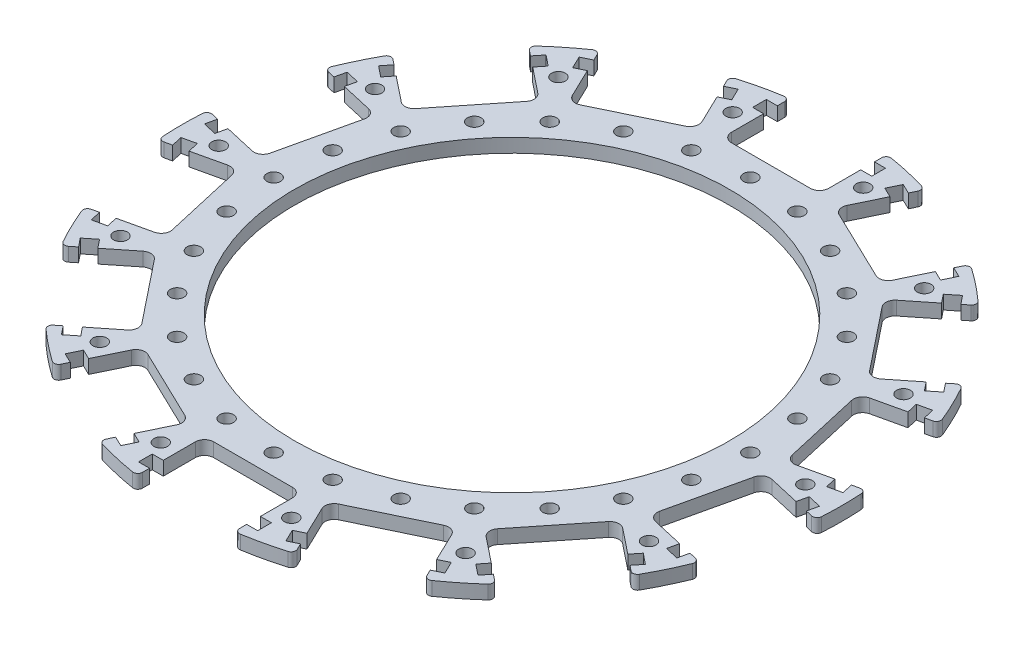
from build123d import *

# Parameters (mm, degrees)
EXTRUDE_1_DEPTH     = 3
FILLET_1_R          = 2
FILLET_2_R          = 1
SKETCH_2_R          = 1.5
CUT_EXTRUDE_1_DEPTH = 11
SKETCH_3_R          = 52.5
SKETCH_3_R_2        = 28
SKETCH_3_R_3        = 9
CUT_EXTRUDE_2_DEPTH = 11
SKETCH_4_R          = 52.5
SKETCH_4_R_2        = 47.5
EXTRUDE_2_DEPTH     = 3
SKETCH_5_R          = 1.5
CUT_EXTRUDE_3_DEPTH = 3


with BuildPart() as part:
    # 草图1 → 凸台-拉伸1 (new body)
    with BuildSketch(Plane(origin=(0, 0, 0), x_dir=(1, 0, 0), z_dir=(0, 1, 0))):
        with BuildLine():
            Line((-10.6, -68.5), (-13, -68.5))
            Line((-13, -68.5), (-13, -65.5))
            Line((-13, -65.5), (-10.6, -65.5))
            Line((-10.6, -65.5), (-10.6, -56.5))
            Line((-10.6, -56.5), (10.6, -56.5))
            Line((10.6, -56.5), (10.6, -65.5))
            Line((10.6, -65.5), (13, -65.5))
            Line((13, -65.5), (13, -68.5))
            Line((13, -68.5), (10.6, -68.5))
            Line((10.6, -68.5), (10.6, -71.215447762))
            ThreePointArc((10.6, -71.215447762), (16.021507245, -70.194809677), (21.348954758, -68.762068982))
            Line((21.348954758, -68.762068982), (20.17076613, -66.315535086))
            Line((20.17076613, -66.315535086), (18.008440847, -67.35685606))
            Line((18.008440847, -67.35685606), (16.706789629, -64.653949456))
            Line((16.706789629, -64.653949456), (18.869114912, -63.612628482))
            Line((18.869114912, -63.612628482), (14.96416126, -55.503908671))
            Line((14.96416126, -55.503908671), (34.06470126, -46.305573402))
            Line((34.06470126, -46.305573402), (37.969654912, -54.414293213))
            Line((37.969654912, -54.414293213), (40.131980195, -53.372972239))
            Line((40.131980195, -53.372972239), (41.433631412, -56.075878843))
            Line((41.433631412, -56.075878843), (39.271306129, -57.117199817))
            Line((39.271306129, -57.117199817), (40.449494758, -59.563733713))
            ThreePointArc((40.449494758, -59.563733713), (44.891265734, -56.291866738), (49.069487199, -52.689519129))
            Line((49.069487199, -52.689519129), (46.946464649, -50.996465141))
            Line((46.946464649, -50.996465141), (45.450089125, -52.872860699))
            Line((45.450089125, -52.872860699), (43.104594677, -51.002391294))
            Line((43.104594677, -51.002391294), (44.600970202, -49.125995736))
            Line((44.600970202, -49.125995736), (37.56448686, -43.514587519))
            Line((37.56448686, -43.514587519), (50.782470659, -26.939760091))
            Line((50.782470659, -26.939760091), (57.818954001, -32.551168308))
            Line((57.818954001, -32.551168308), (59.315329526, -30.67477275))
            Line((59.315329526, -30.67477275), (61.660823973, -32.545242155))
            Line((61.660823973, -32.545242155), (60.164448449, -34.421637713))
            Line((60.164448449, -34.421637713), (62.287470998, -36.114691701))
            ThreePointArc((62.287470998, -36.114691701), (64.869758489, -31.239629216), (67.071205902, -26.181163817))
            Line((67.071205902, -26.181163817), (64.423840085, -25.576919845))
            Line((64.423840085, -25.576919845), (63.889789843, -27.916746834))
            Line((63.889789843, -27.916746834), (60.965006106, -27.249184033))
            Line((60.965006106, -27.249184033), (61.499056348, -24.909357043))
            Line((61.499056348, -24.909357043), (52.724705138, -22.906668638))
            Line((52.724705138, -22.906668638), (57.442148938, -2.238196899))
            Line((57.442148938, -2.238196899), (66.216500148, -4.240885305))
            Line((66.216500148, -4.240885305), (66.750550389, -1.901058316))
            Line((66.750550389, -1.901058316), (69.675334126, -2.568621118))
            Line((69.675334126, -2.568621118), (69.141283884, -4.908448107))
            Line((69.141283884, -4.908448107), (71.788649702, -5.512692079))
            ThreePointArc((71.788649702, -5.512692079), (71.947143024, -2.758371028), (72, 0))
            ThreePointArc((72, 0), (71.947143024, 2.758371028), (71.788649702, 5.512692079))
            Line((71.788649702, 5.512692079), (69.141283884, 4.908448107))
            Line((69.141283884, 4.908448107), (69.675334126, 2.568621118))
            Line((69.675334126, 2.568621118), (66.750550389, 1.901058316))
            Line((66.750550389, 1.901058316), (66.216500148, 4.240885305))
            Line((66.216500148, 4.240885305), (57.442148938, 2.238196899))
            Line((57.442148938, 2.238196899), (52.724705138, 22.906668638))
            Line((52.724705138, 22.906668638), (61.499056348, 24.909357043))
            Line((61.499056348, 24.909357043), (60.965006106, 27.249184033))
            Line((60.965006106, 27.249184033), (63.889789843, 27.916746834))
            Line((63.889789843, 27.916746834), (64.423840085, 25.576919845))
            Line((64.423840085, 25.576919845), (67.071205902, 26.181163817))
            ThreePointArc((67.071205902, 26.181163817), (64.869758489, 31.239629216), (62.287470998, 36.114691701))
            Line((62.287470998, 36.114691701), (60.164448449, 34.421637713))
            Line((60.164448449, 34.421637713), (61.660823973, 32.545242155))
            Line((61.660823973, 32.545242155), (59.315329526, 30.67477275))
            Line((59.315329526, 30.67477275), (57.818954001, 32.551168308))
            Line((57.818954001, 32.551168308), (50.782470659, 26.939760091))
            Line((50.782470659, 26.939760091), (37.56448686, 43.514587519))
            Line((37.56448686, 43.514587519), (44.600970202, 49.125995736))
            Line((44.600970202, 49.125995736), (43.104594677, 51.002391294))
            Line((43.104594677, 51.002391294), (45.450089125, 52.872860699))
            Line((45.450089125, 52.872860699), (46.946464649, 50.996465141))
            Line((46.946464649, 50.996465141), (49.069487199, 52.689519129))
            ThreePointArc((49.069487199, 52.689519129), (44.891265734, 56.291866738), (40.449494758, 59.563733713))
            Line((40.449494758, 59.563733713), (39.271306129, 57.117199817))
            Line((39.271306129, 57.117199817), (41.433631412, 56.075878843))
            Line((41.433631412, 56.075878843), (40.131980195, 53.372972239))
            Line((40.131980195, 53.372972239), (37.969654912, 54.414293213))
            Line((37.969654912, 54.414293213), (34.06470126, 46.305573402))
            Line((34.06470126, 46.305573402), (14.96416126, 55.503908671))
            Line((14.96416126, 55.503908671), (18.869114912, 63.612628482))
            Line((18.869114912, 63.612628482), (16.706789629, 64.653949456))
            Line((16.706789629, 64.653949456), (18.008440847, 67.35685606))
            Line((18.008440847, 67.35685606), (20.17076613, 66.315535086))
            Line((20.17076613, 66.315535086), (21.348954758, 68.762068982))
            ThreePointArc((21.348954758, 68.762068982), (16.021507245, 70.194809677), (10.6, 71.215447762))
            Line((10.6, 71.215447762), (10.6, 68.5))
            Line((10.6, 68.5), (13, 68.5))
            Line((13, 68.5), (13, 65.5))
            Line((13, 65.5), (10.6, 65.5))
            Line((10.6, 65.5), (10.6, 56.5))
            Line((10.6, 56.5), (-10.6, 56.5))
            Line((-10.6, 56.5), (-10.6, 65.5))
            Line((-10.6, 65.5), (-13, 65.5))
            Line((-13, 65.5), (-13, 68.5))
            Line((-13, 68.5), (-10.6, 68.5))
            Line((-10.6, 68.5), (-10.6, 71.215447762))
            ThreePointArc((-10.6, 71.215447762), (-16.021507245, 70.194809677), (-21.348954758, 68.762068982))
            Line((-21.348954758, 68.762068982), (-20.17076613, 66.315535086))
            Line((-20.17076613, 66.315535086), (-18.008440847, 67.35685606))
            Line((-18.008440847, 67.35685606), (-16.706789629, 64.653949456))
            Line((-16.706789629, 64.653949456), (-18.869114912, 63.612628482))
            Line((-18.869114912, 63.612628482), (-14.96416126, 55.503908671))
            Line((-14.96416126, 55.503908671), (-34.06470126, 46.305573402))
            Line((-34.06470126, 46.305573402), (-37.969654912, 54.414293213))
            Line((-37.969654912, 54.414293213), (-40.131980195, 53.372972239))
            Line((-40.131980195, 53.372972239), (-41.433631412, 56.075878843))
            Line((-41.433631412, 56.075878843), (-39.271306129, 57.117199817))
            Line((-39.271306129, 57.117199817), (-40.449494758, 59.563733713))
            ThreePointArc((-40.449494758, 59.563733713), (-44.891265734, 56.291866738), (-49.069487199, 52.689519129))
            Line((-49.069487199, 52.689519129), (-46.946464649, 50.996465141))
            Line((-46.946464649, 50.996465141), (-45.450089125, 52.872860699))
            Line((-45.450089125, 52.872860699), (-43.104594677, 51.002391294))
            Line((-43.104594677, 51.002391294), (-44.600970202, 49.125995736))
            Line((-44.600970202, 49.125995736), (-37.56448686, 43.514587519))
            Line((-37.56448686, 43.514587519), (-50.782470659, 26.939760091))
            Line((-50.782470659, 26.939760091), (-57.818954001, 32.551168308))
            Line((-57.818954001, 32.551168308), (-59.315329526, 30.67477275))
            Line((-59.315329526, 30.67477275), (-61.660823973, 32.545242155))
            Line((-61.660823973, 32.545242155), (-60.164448449, 34.421637713))
            Line((-60.164448449, 34.421637713), (-62.287470998, 36.114691701))
            ThreePointArc((-62.287470998, 36.114691701), (-64.869758489, 31.239629216), (-67.071205902, 26.181163817))
            Line((-67.071205902, 26.181163817), (-64.423840085, 25.576919845))
            Line((-64.423840085, 25.576919845), (-63.889789843, 27.916746834))
            Line((-63.889789843, 27.916746834), (-60.965006106, 27.249184033))
            Line((-60.965006106, 27.249184033), (-61.499056348, 24.909357043))
            Line((-61.499056348, 24.909357043), (-52.724705138, 22.906668638))
            Line((-52.724705138, 22.906668638), (-57.442148938, 2.238196899))
            Line((-57.442148938, 2.238196899), (-66.216500148, 4.240885305))
            Line((-66.216500148, 4.240885305), (-66.750550389, 1.901058316))
            Line((-66.750550389, 1.901058316), (-69.675334126, 2.568621118))
            Line((-69.675334126, 2.568621118), (-69.141283884, 4.908448107))
            Line((-69.141283884, 4.908448107), (-71.788649702, 5.512692079))
            ThreePointArc((-71.788649702, 5.512692079), (-72, 0), (-71.788649702, -5.512692079))
            Line((-71.788649702, -5.512692079), (-69.141283884, -4.908448107))
            Line((-69.141283884, -4.908448107), (-69.675334126, -2.568621118))
            Line((-69.675334126, -2.568621118), (-66.750550389, -1.901058316))
            Line((-66.750550389, -1.901058316), (-66.216500148, -4.240885305))
            Line((-66.216500148, -4.240885305), (-57.442148938, -2.238196899))
            Line((-57.442148938, -2.238196899), (-52.724705138, -22.906668638))
            Line((-52.724705138, -22.906668638), (-61.499056348, -24.909357043))
            Line((-61.499056348, -24.909357043), (-60.965006106, -27.249184033))
            Line((-60.965006106, -27.249184033), (-63.889789843, -27.916746834))
            Line((-63.889789843, -27.916746834), (-64.423840085, -25.576919845))
            Line((-64.423840085, -25.576919845), (-67.071205902, -26.181163817))
            ThreePointArc((-67.071205902, -26.181163817), (-64.869758489, -31.239629216), (-62.287470998, -36.114691701))
            Line((-62.287470998, -36.114691701), (-60.164448449, -34.421637713))
            Line((-60.164448449, -34.421637713), (-61.660823973, -32.545242155))
            Line((-61.660823973, -32.545242155), (-59.315329526, -30.67477275))
            Line((-59.315329526, -30.67477275), (-57.818954001, -32.551168308))
            Line((-57.818954001, -32.551168308), (-50.782470659, -26.939760091))
            Line((-50.782470659, -26.939760091), (-37.56448686, -43.514587519))
            Line((-37.56448686, -43.514587519), (-44.600970202, -49.125995736))
            Line((-44.600970202, -49.125995736), (-43.104594677, -51.002391294))
            Line((-43.104594677, -51.002391294), (-45.450089125, -52.872860699))
            Line((-45.450089125, -52.872860699), (-46.946464649, -50.996465141))
            Line((-46.946464649, -50.996465141), (-49.069487199, -52.689519129))
            ThreePointArc((-49.069487199, -52.689519129), (-44.891265734, -56.291866738), (-40.449494758, -59.563733713))
            Line((-40.449494758, -59.563733713), (-39.271306129, -57.117199817))
            Line((-39.271306129, -57.117199817), (-41.433631412, -56.075878843))
            Line((-41.433631412, -56.075878843), (-40.131980195, -53.372972239))
            Line((-40.131980195, -53.372972239), (-37.969654912, -54.414293213))
            Line((-37.969654912, -54.414293213), (-34.06470126, -46.305573402))
            Line((-34.06470126, -46.305573402), (-14.96416126, -55.503908671))
            Line((-14.96416126, -55.503908671), (-18.869114912, -63.612628482))
            Line((-18.869114912, -63.612628482), (-16.706789629, -64.653949456))
            Line((-16.706789629, -64.653949456), (-18.008440847, -67.35685606))
            Line((-18.008440847, -67.35685606), (-20.17076613, -66.315535086))
            Line((-20.17076613, -66.315535086), (-21.348954758, -68.762068982))
            ThreePointArc((-21.348954758, -68.762068982), (-16.021507245, -70.194809677), (-10.6, -71.215447762))
            Line((-10.6, -71.215447762), (-10.6, -68.5))
        make_face()
    extrude(amount=EXTRUDE_1_DEPTH)

    # 圆角1
    fillet_1_edges = [part.edges().sort_by_distance(p)[0] for p in [
        (10.6, 1.5, 56.5),
        (-10.6, 1.5, 56.5),
        (-14.96416126, 1.5, 55.503908671),
        (-34.06470126, 1.5, 46.305573402),
        (-37.56448686, 1.5, 43.514587519),
        (-50.782470659, 1.5, 26.939760091),
        (-52.724705138, 1.5, 22.906668638),
        (-57.442148938, 1.5, 2.238196899),
        (-57.442148938, 1.5, -2.238196899),
        (-52.724705138, 1.5, -22.906668638),
        (-50.782470659, 1.5, -26.939760091),
        (-37.56448686, 1.5, -43.514587519),
        (-34.06470126, 1.5, -46.305573402),
        (-14.96416126, 1.5, -55.503908671),
        (-10.6, 1.5, -56.5),
        (10.6, 1.5, -56.5),
        (14.96416126, 1.5, -55.503908671),
        (34.06470126, 1.5, -46.305573402),
        (37.56448686, 1.5, -43.514587519),
        (50.782470659, 1.5, -26.939760091),
        (52.724705138, 1.5, -22.906668638),
        (57.442148938, 1.5, -2.238196899),
        (57.442148938, 1.5, 2.238196899),
        (52.724705138, 1.5, 22.906668638),
        (50.782470659, 1.5, 26.939760091),
        (37.56448686, 1.5, 43.514587519),
        (34.06470126, 1.5, 46.305573402),
        (14.96416126, 1.5, 55.503908671),
    ]]
    fillet(fillet_1_edges, radius=FILLET_1_R)

    # 圆角2
    fillet_2_edges = [part.edges().sort_by_distance(p)[0] for p in [
        (-10.6, 1.5, 71.215447762),
        (-21.348954758, 1.5, 68.762068982),
        (-40.449494758, 1.5, 59.563733713),
        (-49.069487199, 1.5, 52.689519129),
        (-62.287470998, 1.5, 36.114691701),
        (-67.071205902, 1.5, 26.181163817),
        (-71.788649702, 1.5, 5.512692079),
        (-71.788649702, 1.5, -5.512692079),
        (-67.071205902, 1.5, -26.181163817),
        (-62.287470998, 1.5, -36.114691701),
        (-49.069487199, 1.5, -52.689519129),
        (-40.449494758, 1.5, -59.563733713),
        (-21.348954758, 1.5, -68.762068982),
        (-10.6, 1.5, -71.215447762),
        (10.6, 1.5, -71.215447762),
        (21.348954758, 1.5, -68.762068982),
        (40.449494758, 1.5, -59.563733713),
        (49.069487199, 1.5, -52.689519129),
        (62.287470998, 1.5, -36.114691701),
        (67.071205902, 1.5, -26.181163817),
        (71.788649702, 1.5, -5.512692079),
        (71.788649702, 1.5, 5.512692079),
        (67.071205902, 1.5, 26.181163817),
        (62.287470998, 1.5, 36.114691701),
        (49.069487199, 1.5, 52.689519129),
        (40.449494758, 1.5, 59.563733713),
        (21.348954758, 1.5, 68.762068982),
        (10.6, 1.5, 71.215447762),
    ]]
    fillet(fillet_2_edges, radius=FILLET_2_R)

    # 草图2 → 切除-拉伸1 (cut)
    with BuildSketch(Plane(origin=(0, 0, 0), x_dir=(1, 0, 0), z_dir=(0, 1, 0))):
        with Locations(Location((64, 0, 0), (0, 0, 270))):
            Circle(SKETCH_2_R)
        with Locations(Location((57.662007546, -27.768559304, 0), (0, 0, 270))):
            Circle(SKETCH_2_R)
        with Locations(Location((39.903347319, -50.037214878, 0), (0, 0, 270))):
            Circle(SKETCH_2_R)
        with Locations(Location((14.241339773, -62.39538638, 0), (0, 0, 270))):
            Circle(SKETCH_2_R)
        with Locations(Location((-14.241339773, -62.39538638, 0), (0, 0, 270))):
            Circle(SKETCH_2_R)
        with Locations(Location((-39.903347319, -50.037214878, 0), (0, 0, 270))):
            Circle(SKETCH_2_R)
        with Locations(Location((-57.662007546, -27.768559304, 0), (0, 0, 270))):
            Circle(SKETCH_2_R)
        with Locations(Location((-64, 0, 0), (0, 0, 270))):
            Circle(SKETCH_2_R)
        with Locations(Location((-57.662007546, 27.768559304, 0), (0, 0, 270))):
            Circle(SKETCH_2_R)
        with Locations(Location((-39.903347319, 50.037214878, 0), (0, 0, 270))):
            Circle(SKETCH_2_R)
        with Locations(Location((-14.241339773, 62.39538638, 0), (0, 0, 270))):
            Circle(SKETCH_2_R)
        with Locations(Location((14.241339773, 62.39538638, 0), (0, 0, 270))):
            Circle(SKETCH_2_R)
        with Locations(Location((39.903347319, 50.037214878, 0), (0, 0, 270))):
            Circle(SKETCH_2_R)
        with Locations(Location((57.662007546, 27.768559304, 0), (0, 0, 270))):
            Circle(SKETCH_2_R)
    extrude(amount=CUT_EXTRUDE_1_DEPTH, mode=Mode.SUBTRACT)

    # 草图3 → 切除-拉伸2 (cut)
    # profile 1 of 2: a face of its own
    with BuildSketch(Plane(origin=(0, 0, 0), x_dir=(1, 0, 0), z_dir=(0, 1, 0))):
        with Locations(Location((0, 0, 0), (0, 0, 270))):
            Circle(SKETCH_3_R)
        Circle(SKETCH_3_R_2, mode=Mode.SUBTRACT)
    # profile 2 of 2: a face of its own
    with BuildSketch(Plane(origin=(0, 0, 0), x_dir=(1, 0, 0), z_dir=(0, 1, 0))):
        Circle(SKETCH_3_R_3)
    extrude(amount=CUT_EXTRUDE_2_DEPTH, mode=Mode.SUBTRACT)


with BuildPart() as cut_extrude_2_kept_piece:
    # of the separate pieces the step leaves, the one the design keeps (cut_extrude_2_pieces_kept)
    add(part.part.solids().sort_by_distance((-10.6, 3, 70.045984896))[0])

    # 草图4 → 凸台-拉伸2 (add)
    with BuildSketch(Plane(origin=(0, 3, 0), x_dir=(1, 0, 0), z_dir=(0, 1, 0))):
        Circle(SKETCH_4_R)
        with Locations(Location((0, 0, 0), (0, 0, 270))):
            Circle(SKETCH_4_R_2, mode=Mode.SUBTRACT)
    extrude(amount=-EXTRUDE_2_DEPTH)

    # 草图5 → 切除-拉伸3 (cut)
    with BuildSketch(Plane(origin=(0, 3, 0), x_dir=(1, 0, 0), z_dir=(0, 1, 0))):
        with Locations(Location((0, 52, 0), (0, 0, 270))):
            Circle(SKETCH_5_R)
        with Locations(Location((11.571088566, 50.696251433, 0), (0, 0, 270))):
            Circle(SKETCH_5_R)
        with Locations(Location((22.561954434, 46.850381131, 0), (0, 0, 270))):
            Circle(SKETCH_5_R)
        with Locations(Location((32.421469697, 40.655237088, 0), (0, 0, 270))):
            Circle(SKETCH_5_R)
        with Locations(Location((40.655237088, 32.421469697, 0), (0, 0, 270))):
            Circle(SKETCH_5_R)
        with Locations(Location((46.850381131, 22.561954434, 0), (0, 0, 270))):
            Circle(SKETCH_5_R)
        with Locations(Location((50.696251433, 11.571088566, 0), (0, 0, 270))):
            Circle(SKETCH_5_R)
        with Locations(Location((52, 0, 0), (0, 0, 270))):
            Circle(SKETCH_5_R)
        with Locations(Location((50.696251433, -11.571088566, 0), (0, 0, 270))):
            Circle(SKETCH_5_R)
        with Locations(Location((46.850381131, -22.561954434, 0), (0, 0, 270))):
            Circle(SKETCH_5_R)
        with Locations(Location((40.655237088, -32.421469697, 0), (0, 0, 270))):
            Circle(SKETCH_5_R)
        with Locations(Location((32.421469697, -40.655237088, 0), (0, 0, 270))):
            Circle(SKETCH_5_R)
        with Locations(Location((22.561954434, -46.850381131, 0), (0, 0, 270))):
            Circle(SKETCH_5_R)
        with Locations(Location((11.571088566, -50.696251433, 0), (0, 0, 270))):
            Circle(SKETCH_5_R)
        with Locations(Location((0, -52, 0), (0, 0, 270))):
            Circle(SKETCH_5_R)
        with Locations(Location((-11.571088566, -50.696251433, 0), (0, 0, 270))):
            Circle(SKETCH_5_R)
        with Locations(Location((-22.561954434, -46.850381131, 0), (0, 0, 270))):
            Circle(SKETCH_5_R)
        with Locations(Location((-32.421469697, -40.655237088, 0), (0, 0, 270))):
            Circle(SKETCH_5_R)
        with Locations(Location((-40.655237088, -32.421469697, 0), (0, 0, 270))):
            Circle(SKETCH_5_R)
        with Locations(Location((-46.850381131, -22.561954434, 0), (0, 0, 270))):
            Circle(SKETCH_5_R)
        with Locations(Location((-50.696251433, -11.571088566, 0), (0, 0, 270))):
            Circle(SKETCH_5_R)
        with Locations(Location((-52, 0, 0), (0, 0, 270))):
            Circle(SKETCH_5_R)
        with Locations(Location((-50.696251433, 11.571088566, 0), (0, 0, 270))):
            Circle(SKETCH_5_R)
        with Locations(Location((-46.850381131, 22.561954434, 0), (0, 0, 270))):
            Circle(SKETCH_5_R)
        with Locations(Location((-40.655237088, 32.421469697, 0), (0, 0, 270))):
            Circle(SKETCH_5_R)
        with Locations(Location((-32.421469697, 40.655237088, 0), (0, 0, 270))):
            Circle(SKETCH_5_R)
        with Locations(Location((-22.561954434, 46.850381131, 0), (0, 0, 270))):
            Circle(SKETCH_5_R)
        with Locations(Location((-11.571088566, 50.696251433, 0), (0, 0, 270))):
            Circle(SKETCH_5_R)
    extrude(amount=-CUT_EXTRUDE_3_DEPTH, mode=Mode.SUBTRACT)


solid = cut_extrude_2_kept_piece.part
